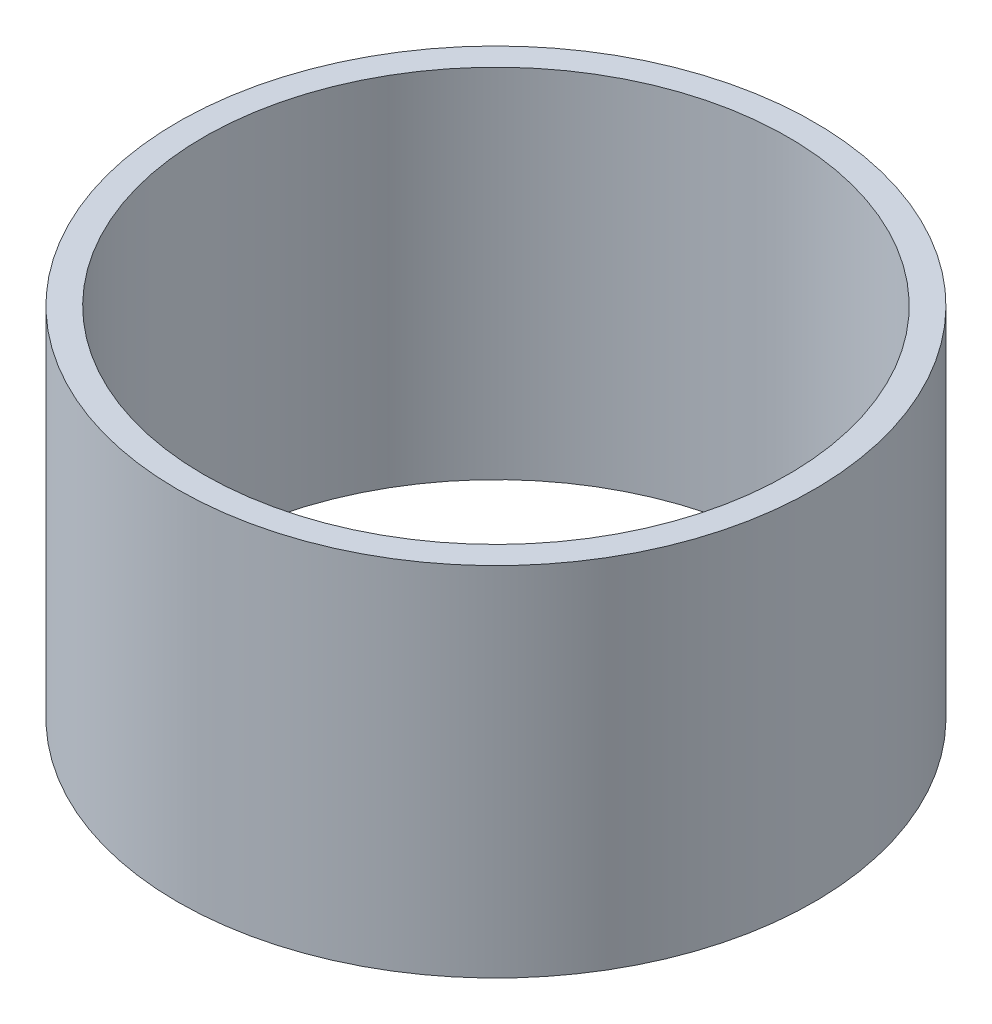
from build123d import *

# Parameters (mm, degrees)
CROQUIS1_R              = 49
CROQUIS1_R_2            = 45
SALIENTE_EXTRUIR1_DEPTH = 55


with BuildPart() as part:
    # Croquis1 → Saliente-Extruir1 (new body)
    with BuildSketch(Plane(origin=(0, 0, 0), x_dir=(1, 0, 0), z_dir=(0, 1, 0))):
        with Locations(Location((0, 0, 0), (0, 0, 270))):
            Circle(CROQUIS1_R)
        with Locations(Location((0, 0, 0), (0, 0, 270))):
            Circle(CROQUIS1_R_2, mode=Mode.SUBTRACT)
    extrude(amount=SALIENTE_EXTRUIR1_DEPTH)


solid = part.part
